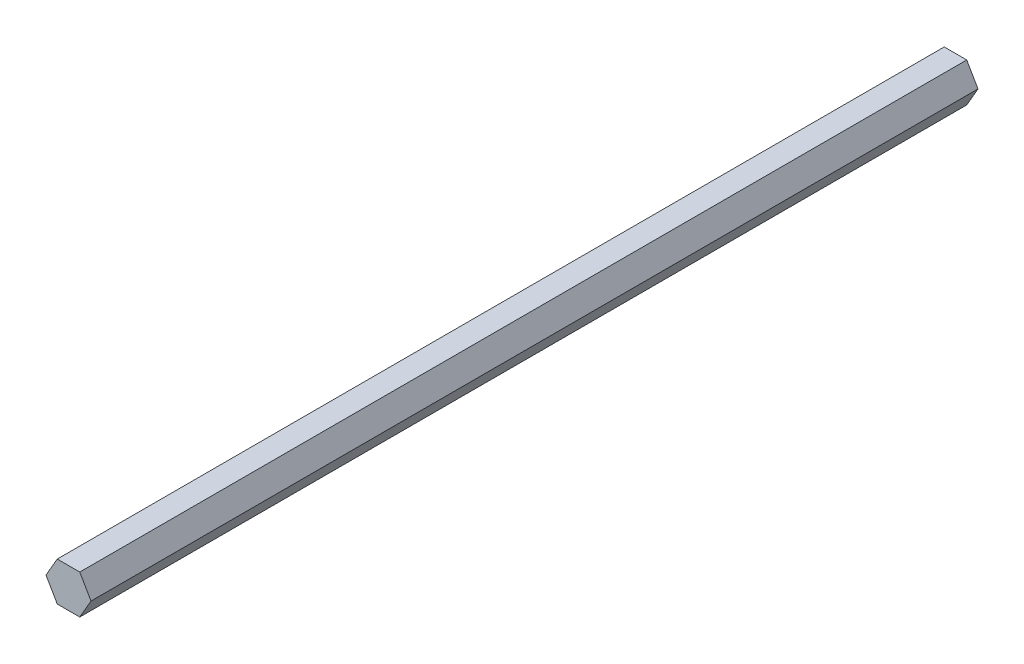
from build123d import *

# Parameters (mm, degrees)
BOSS_EXTRUDE1_DEPTH = 144.4625


with BuildPart() as part:
    # Sketch1 → Boss-Extrude1 (new, symmetric)
    with BuildSketch(Plane.XY):
        Polygon((7.332348419, 0), (3.666174209, 6.35), (-3.666174209, 6.35), (-7.332348419, 0), (-3.666174209, -6.35), (3.666174209, -6.35), align=None)
    extrude(amount=BOSS_EXTRUDE1_DEPTH, both=True)


solid = part.part
